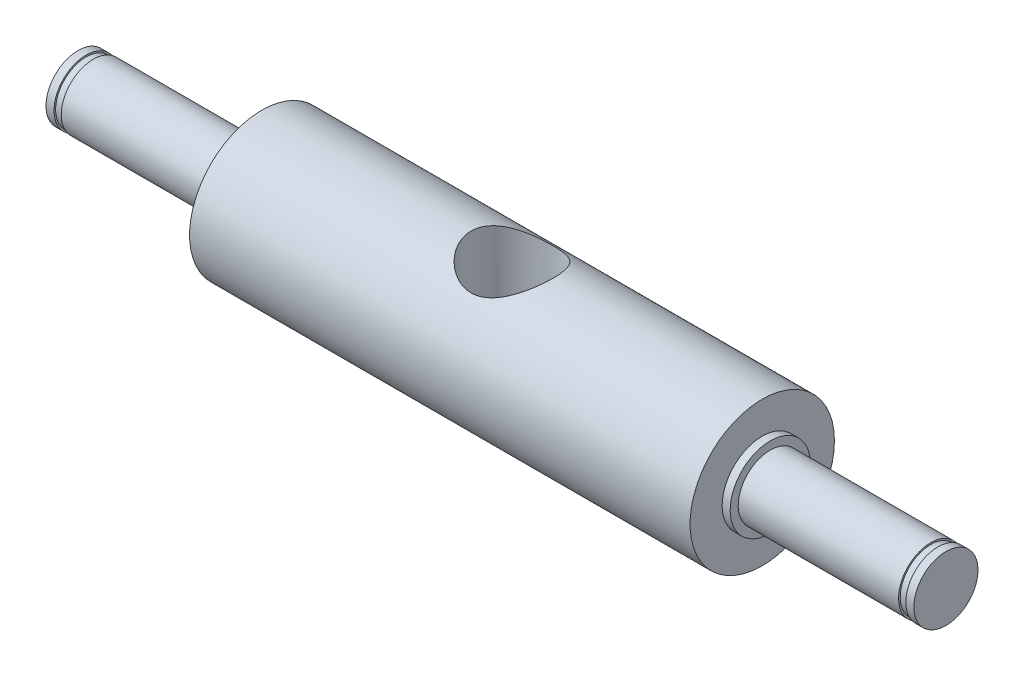
from build123d import *

# Parameters (mm, degrees)
SKETCH1_R               = 9
BOSS_EXTRUDE1_DEPTH     = 31.2
CUT_EXTRUDE1_DEPTH      = 34.696290597
CUT_EXTRUDE1_DEPTH_BACK = 34.696290597
SKETCH2_R               = 5.1
SKETCH7_R               = 5.25
SKETCH7_R_2             = 3
BOSS_EXTRUDE2_DEPTH     = 5


with BuildPart() as part:
    # Sketch1 → Boss-Extrude1 (new, symmetric)
    with BuildSketch(Plane(origin=(0, 0, 0), x_dir=(0, 0, -1), z_dir=(1, 0, 0))):
        Circle(SKETCH1_R)
    extrude(amount=BOSS_EXTRUDE1_DEPTH, both=True)

    # Sketch2 → Cut-Extrude1 (cut, two sides: drawn at the far end of the back side and taken through both)
    with BuildSketch(Plane(origin=(0, 0, 0), x_dir=(1, 0, 0), z_dir=(0, 1, 0)).offset(-CUT_EXTRUDE1_DEPTH_BACK)):
        with Locations(Location((0, 0, 0), (0, 0, 270))):
            Circle(SKETCH2_R)
    extrude(amount=CUT_EXTRUDE1_DEPTH + CUT_EXTRUDE1_DEPTH_BACK, mode=Mode.SUBTRACT)

    # Sketch6 → Revolve1 (revolve)
    with BuildSketch(Plane.XY):
        Polygon((31.2, 0), (31.2, 5), (32.2, 5), (32.2, 4), (52.2, 4), (52.2, 3.8), (53.1, 3.8), (53.1, 4), (54.1, 4), (54.1, 0), align=None)
    revolve1 = revolve(axis=Axis((54.1, 0, 0), (-1, 0, 0)))

    # Mirror1: Revolve1 across plane
    add(revolve1.mirror(Plane(origin=(0, 0, 0), x_dir=(0, 0, 1), z_dir=(1, 0, 0))))

    # Sketch7 → Boss-Extrude2 (add)
    with BuildSketch(Plane(origin=(0, 0, 0), x_dir=(1, 0, 0), z_dir=(0, 1, 0))):
        Circle(SKETCH7_R)
        with Locations(Location((0, 0, 0), (0, 0, 270))):
            Circle(SKETCH7_R_2, mode=Mode.SUBTRACT)
    extrude(amount=-BOSS_EXTRUDE2_DEPTH)


solid = part.part
